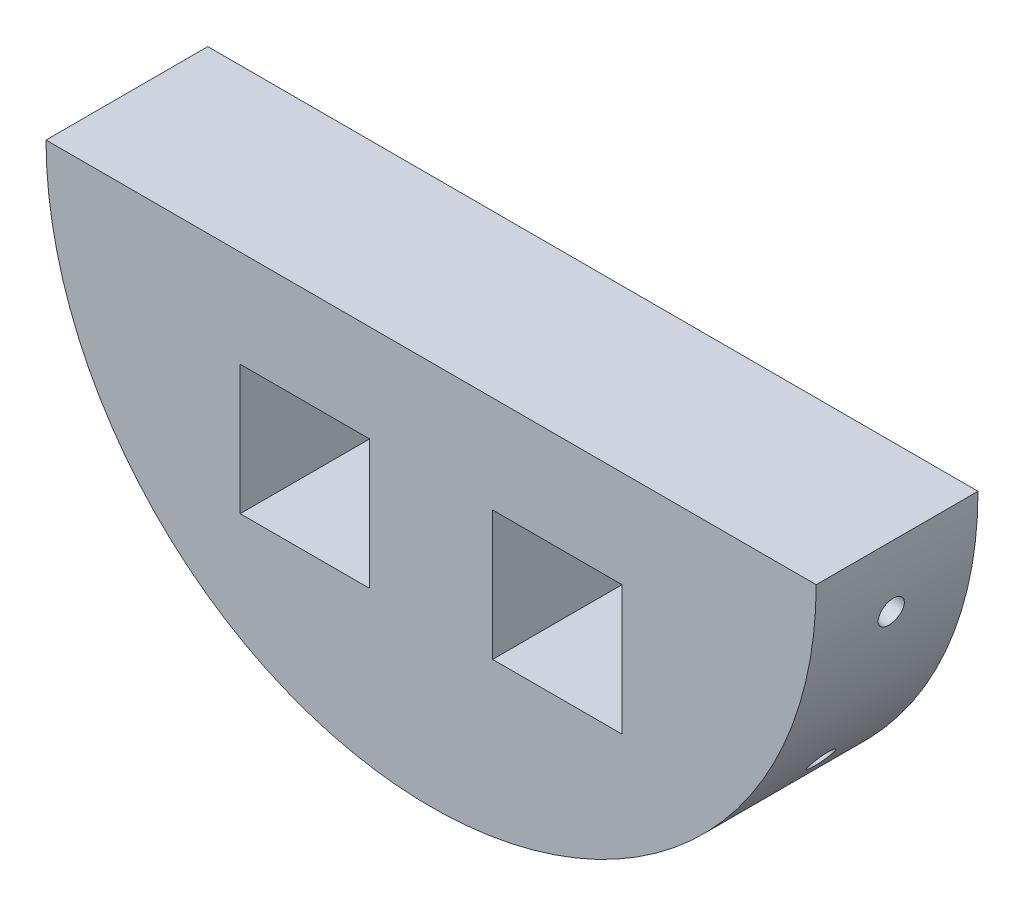
from build123d import *

# Parameters (mm, degrees)
SKETCH1_W           = 20
SKETCH1_H           = 20
BOSS_EXTRUDE1_DEPTH = 25
HOLE1_D             = 4
HOLE1_DEPTH         = 10
CUT_EXTRUDE1_DEPTH  = 18
CIRPATTERN1_COUNT   = 7
CIRPATTERN1_ANGLE   = 160


with BuildPart() as part:
    # Sketch1 → Boss-Extrude1 (new body)
    with BuildSketch(Plane.XY):
        with BuildLine():
            Line((-119, 0), (0, 0))
            ThreePointArc((0, 0), (-59.5, -59.5), (-119, 0))
        make_face()
        with Locations((-40, -25)):
            Rectangle(SKETCH1_W, SKETCH1_H, mode=Mode.SUBTRACT)
        with Locations((-79, -25)):
            Rectangle(SKETCH1_W, SKETCH1_H, mode=Mode.SUBTRACT)
    extrude(amount=BOSS_EXTRUDE1_DEPTH)

    # Hole1
    with Locations(Plane(origin=(-0.903938696, -10.332066571, 12.5), x_dir=(0.173648177667, 0.984807753012, 0), z_dir=(0.984807753012, -0.173648177667, 0))):
        with Locations((0, 0)):
            hole1 = Hole(HOLE1_D / 2, depth=HOLE1_DEPTH)

    # Sketch7 → Cut-Extrude1 (cut)
    with BuildSketch(Plane(origin=(0, 0, 0), x_dir=(-1, 0, 0), z_dir=(0, 0, -1))):
        Polygon((4.872912484, -4.047383041), (6.783042438, -14.880268324), (11.707081203, -14.012027436), (9.796951249, -3.179142153), align=None)
    cut_extrude1 = extrude(amount=-CUT_EXTRUDE1_DEPTH, mode=Mode.SUBTRACT)

    # CirPattern1: Hole1, Cut-Extrude1 ×7 about axis
    cirpattern1_axis = Axis((-59.5, 0, 0), (0, 0, -1))
    add([hole1.rotate(cirpattern1_axis, i * CIRPATTERN1_ANGLE / (CIRPATTERN1_COUNT - 1)) for i in range(1, CIRPATTERN1_COUNT)], mode=Mode.SUBTRACT)
    add([cut_extrude1.rotate(cirpattern1_axis, i * CIRPATTERN1_ANGLE / (CIRPATTERN1_COUNT - 1)) for i in range(1, CIRPATTERN1_COUNT)], mode=Mode.SUBTRACT)


solid = part.part
